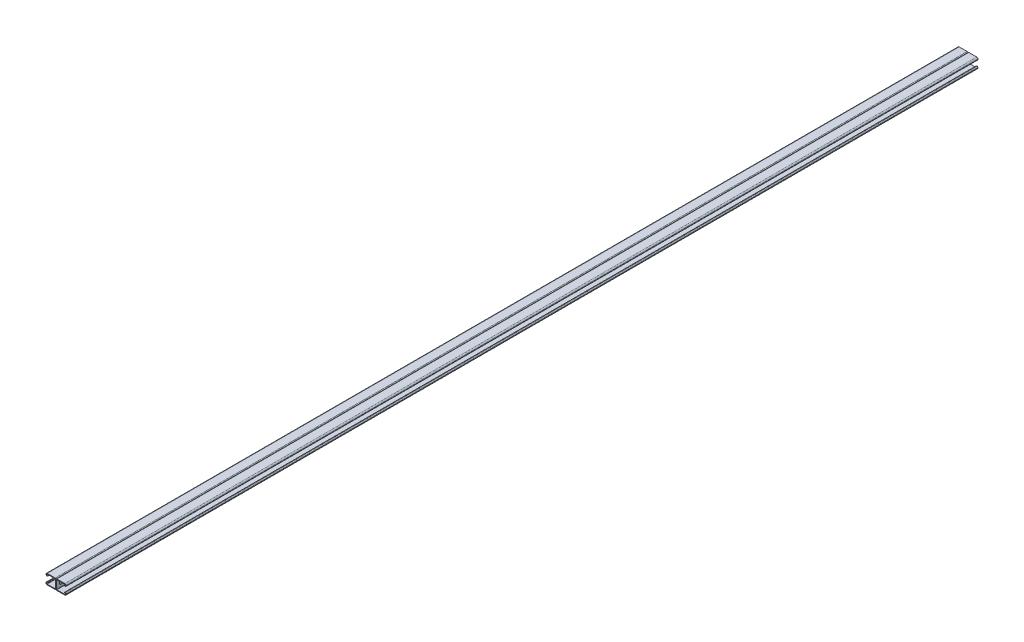
from build123d import *

# Parameters (mm, degrees)
BOSS_EXTRUDE1_DEPTH = 3759.2
CUT_EXTRUDE1_DEPTH  = 2.794
LPATTERN1_COUNT     = 74
LPATTERN1_PITCH     = 50.8


with BuildPart() as part:
    # Sketch1 → Boss-Extrude1 (new body)
    with BuildSketch(Plane.XY):
        with BuildLine():
            Line((-36.22675, 20.6375), (-3.46075, 20.6375))
            ThreePointArc((-3.46075, 20.6375), (-1.013630207, 19.623869793), (0, 17.17675))
            Line((0, 17.17675), (0, -17.17675))
            ThreePointArc((0, -17.17675), (-1.013630207, -19.623869793), (-3.46075, -20.6375))
            Line((-3.46075, -20.6375), (-36.22675, -20.6375))
            ThreePointArc((-36.22675, -20.6375), (-39.796401808, -19.158901808), (-41.275, -15.58925))
            Line((-41.275, -15.58925), (-41.275, -14.57325))
            ThreePointArc((-41.275, -14.57325), (-40.261369793, -12.126130207), (-37.81425, -11.1125))
            Line((-37.81425, -11.1125), (-35.5346, -11.1125))
            ThreePointArc((-35.5346, -11.1125), (-34.1376, -12.5095), (-35.5346, -13.9065))
            Line((-35.5346, -13.9065), (-37.81425, -13.9065))
            ThreePointArc((-37.81425, -13.9065), (-38.285713446, -14.101786554), (-38.481, -14.57325))
            Line((-38.481, -14.57325), (-38.481, -15.58925))
            ThreePointArc((-38.481, -15.58925), (-37.820745461, -17.183245461), (-36.22675, -17.8435))
            Line((-36.22675, -17.8435), (-3.46075, -17.8435))
            ThreePointArc((-3.46075, -17.8435), (-2.989286554, -17.648213446), (-2.794, -17.17675))
            Line((-2.794, -17.17675), (-2.794, 17.17675))
            ThreePointArc((-2.794, 17.17675), (-2.989286554, 17.648213446), (-3.46075, 17.8435))
            Line((-3.46075, 17.8435), (-36.22675, 17.8435))
            ThreePointArc((-36.22675, 17.8435), (-37.820745461, 17.183245461), (-38.481, 15.58925))
            Line((-38.481, 15.58925), (-38.481, 14.57325))
            ThreePointArc((-38.481, 14.57325), (-38.285713446, 14.101786554), (-37.81425, 13.9065))
            Line((-37.81425, 13.9065), (-35.5346, 13.9065))
            ThreePointArc((-35.5346, 13.9065), (-34.1376, 12.5095), (-35.5346, 11.1125))
            Line((-35.5346, 11.1125), (-37.81425, 11.1125))
            ThreePointArc((-37.81425, 11.1125), (-40.261369793, 12.126130207), (-41.275, 14.57325))
            Line((-41.275, 14.57325), (-41.275, 15.58925))
            ThreePointArc((-41.275, 15.58925), (-39.796401808, 19.158901808), (-36.22675, 20.6375))
        make_face()
    extrude(amount=-BOSS_EXTRUDE1_DEPTH)

    # Sketch2 → Cut-Extrude1 (cut)
    with BuildSketch(Plane(origin=(0, 0, 0), x_dir=(0, 0, -1), z_dir=(1, 0, 0))):
        with BuildLine():
            Line((18.25625, 7.14375), (32.54375, 7.14375))
            ThreePointArc((32.54375, 7.14375), (39.6875, 0), (32.54375, -7.14375))
            Line((32.54375, -7.14375), (18.25625, -7.14375))
            ThreePointArc((18.25625, -7.14375), (11.1125, 0), (18.25625, 7.14375))
        make_face()
    cut_extrude1 = extrude(amount=-CUT_EXTRUDE1_DEPTH, mode=Mode.SUBTRACT)

    # LPattern1: Cut-Extrude1 ×74
    with Locations(*[(0, 0, -i * LPATTERN1_PITCH) for i in range(1, LPATTERN1_COUNT)]):
        add(cut_extrude1, mode=Mode.SUBTRACT)


with BuildPart() as body_2:
    # Mirror1: mirrored copy
    add(part.part.mirror(Plane(origin=(0, 17.17675, -3759.2), x_dir=(0, 0, 1), z_dir=(1, 0, 0))))


solid = Compound([part.part, body_2.part])
